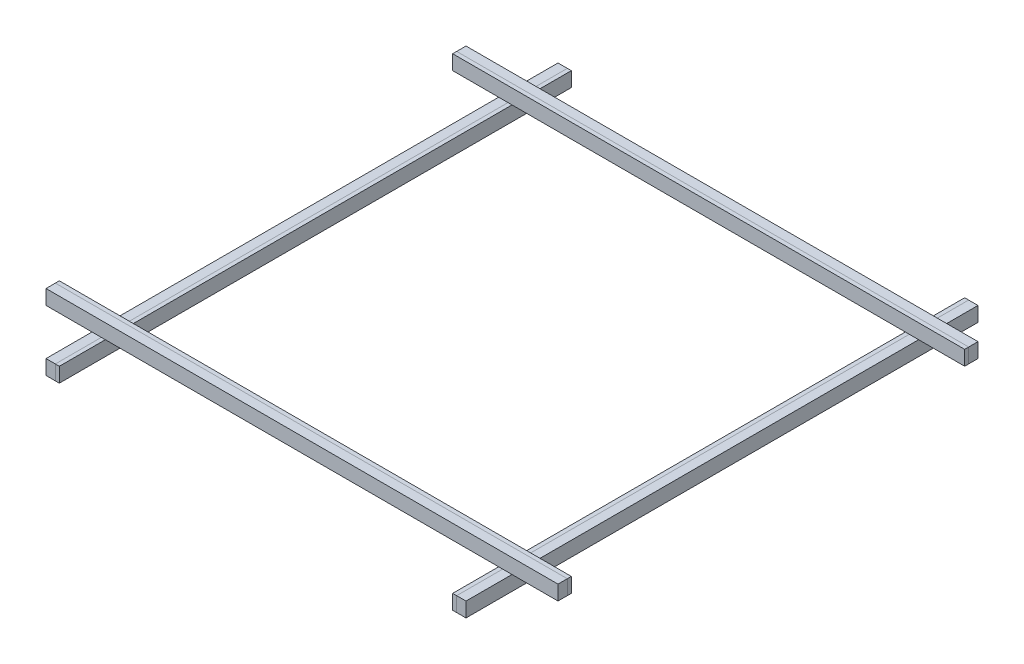
from build123d import *

# Parameters (mm, degrees)
SKETCH1_W              = 88.9
SKETCH1_H              = 139.7
PROFILES_4X6_1_DEPTH   = 4876.8
SKETCH1_ON_SEGMENT_2_W = 88.9
SKETCH1_ON_SEGMENT_2_H = 139.7
PROFILES_4X6_1_2_DEPTH = 4876.8
SKETCH1_ON_SEGMENT_3_W = 88.9
SKETCH1_ON_SEGMENT_3_H = 139.7
PROFILES_4X6_1_3_DEPTH = 4876.8
SKETCH1_ON_SEGMENT_4_W = 88.9
SKETCH1_ON_SEGMENT_4_H = 139.7
PROFILES_4X6_1_4_DEPTH = 4876.8
SKETCH13_W             = 38.1
SKETCH13_H             = 139.7
BOSS_EXTRUDE1_DEPTH    = 4876.8
BOSS_EXTRUDE1_2_DEPTH  = 4876.8
SKETCH14_W             = 38.1
SKETCH14_H             = 139.7
BOSS_EXTRUDE2_DEPTH    = 4876.8
BOSS_EXTRUDE2_2_DEPTH  = 4876.8


with BuildPart() as part:
    # Sketch1 → Profiles 4X6(1) (new body)
    with BuildSketch(Plane(origin=(177.8, 0, 0), x_dir=(-1, 0, 0), z_dir=(0, 0, -1))):
        Rectangle(SKETCH1_W, SKETCH1_H)
    extrude(amount=PROFILES_4X6_1_DEPTH)


with BuildPart() as body_2:
    # Sketch1 on segment 2 (carried to segment 2) → Profiles 4X6_1 2 (new body)
    with BuildSketch(Plane(origin=(4089.4, 0, 0), x_dir=(-1, 0, 0), z_dir=(0, 0, -1))):
        Rectangle(SKETCH1_ON_SEGMENT_2_W, SKETCH1_ON_SEGMENT_2_H)
    extrude(amount=PROFILES_4X6_1_2_DEPTH)


with BuildPart() as body_3:
    # Sketch1 on segment 3 (carried to segment 3) → Profiles 4X6_1 3 (new body)
    with BuildSketch(Plane(origin=(-304.8, 139.7, -4394.2), x_dir=(0, 0, -1), z_dir=(1, 0, 0))):
        Rectangle(SKETCH1_ON_SEGMENT_3_W, SKETCH1_ON_SEGMENT_3_H)
    extrude(amount=PROFILES_4X6_1_3_DEPTH)


with BuildPart() as body_4:
    # Sketch1 on segment 4 (carried to segment 4) → Profiles 4X6_1 4 (new body)
    with BuildSketch(Plane(origin=(4572, 139.7, -482.6), x_dir=(0, 0, 1), z_dir=(-1, 0, 0))):
        Rectangle(SKETCH1_ON_SEGMENT_4_W, SKETCH1_ON_SEGMENT_4_H)
    extrude(amount=PROFILES_4X6_1_4_DEPTH)


with BuildPart() as body_5:
    # Sketch13 → Boss-Extrude1 (new body)
    with BuildSketch(Plane.ZY.offset(304.8)):
        with Locations((-4330.7, 139.7)):
            Rectangle(SKETCH13_W, SKETCH13_H)
    extrude(amount=-BOSS_EXTRUDE1_DEPTH)


with BuildPart() as body_6:
    # Sketch13 → Boss-Extrude1 2 (new body)
    with BuildSketch(Plane.ZY.offset(304.8)):
        with Locations((-546.1, 139.7)):
            Rectangle(SKETCH13_W, SKETCH13_H)
    extrude(amount=-BOSS_EXTRUDE1_2_DEPTH)


with BuildPart() as body_7:
    # Sketch14 → Boss-Extrude2 (new body)
    with BuildSketch(Plane.XY):
        with Locations((241.3, 0)):
            Rectangle(SKETCH14_W, SKETCH14_H)
    extrude(amount=-BOSS_EXTRUDE2_DEPTH)


with BuildPart() as body_8:
    # Sketch14 → Boss-Extrude2 2 (new body)
    with BuildSketch(Plane.XY):
        with Locations((4025.9, 0)):
            Rectangle(SKETCH14_W, SKETCH14_H)
    extrude(amount=-BOSS_EXTRUDE2_2_DEPTH)


solid = Compound([part.part, body_2.part, body_3.part, body_4.part, body_5.part, body_6.part, body_7.part, body_8.part])
